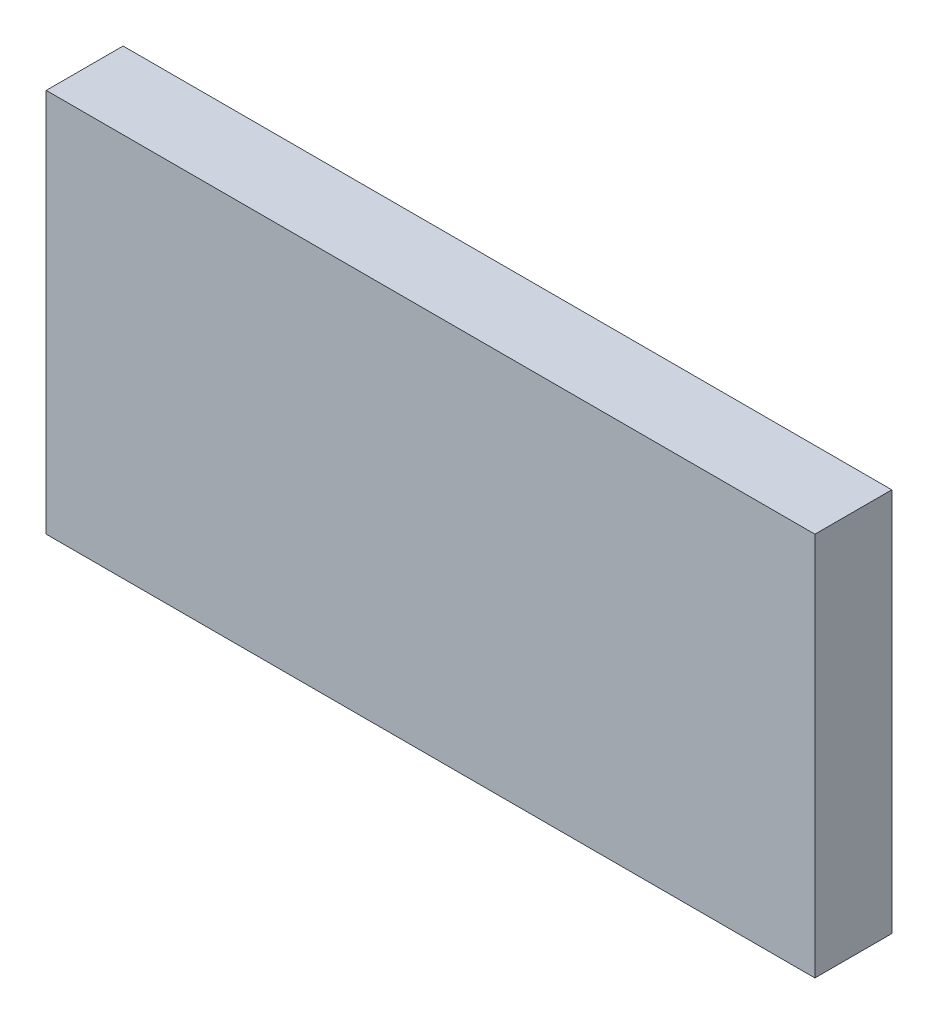
from build123d import *

# Parameters (mm, degrees)
SKETCH1_W           = 40
SKETCH1_H           = 20
BOSS_EXTRUDE1_DEPTH = 4


with BuildPart() as part:
    # Sketch1 → Boss-Extrude1 (new body)
    with BuildSketch(Plane.XY):
        with Locations((20, 10)):
            Rectangle(SKETCH1_W, SKETCH1_H)
    extrude(amount=-BOSS_EXTRUDE1_DEPTH)


solid = part.part
